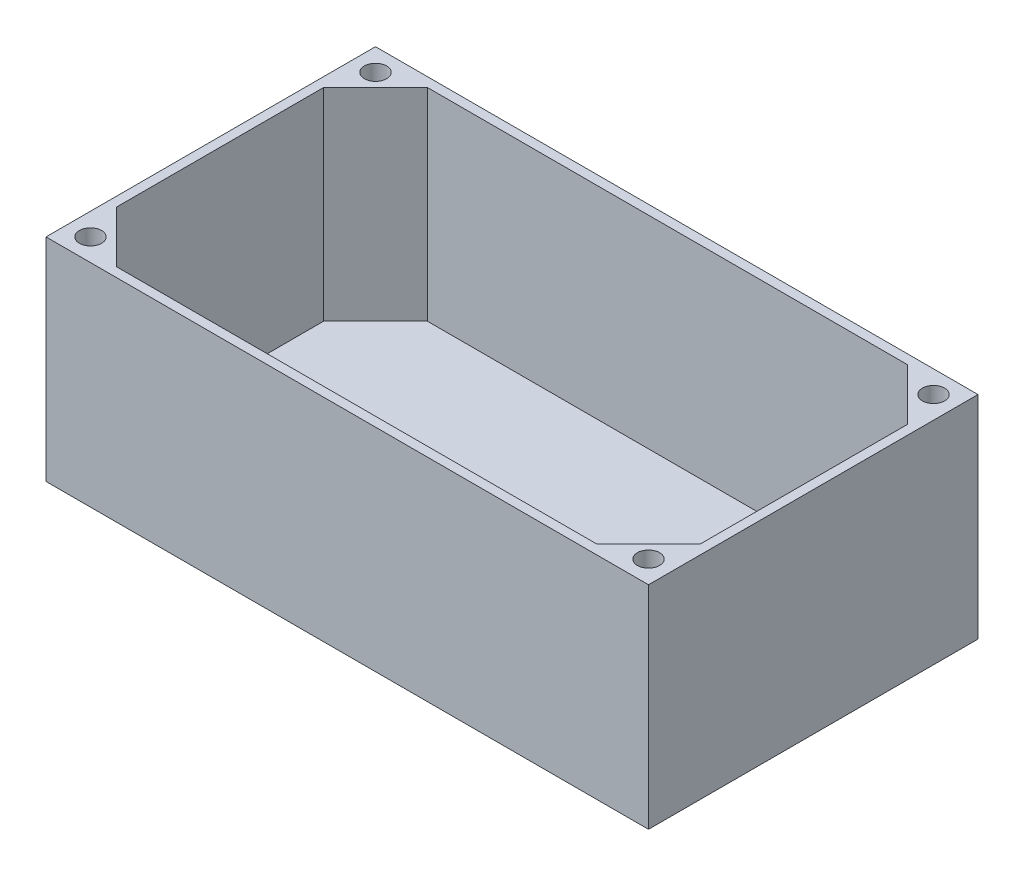
from build123d import *

# Parameters (mm, degrees)
SKETCH1_W           = 81.28
SKETCH1_H           = 44.45
BOSS_EXTRUDE1_DEPTH = 28.575
SHELL1_T            = -1.27
CHAMFER1_SIZE       = 6.985
SKETCH2_R           = 1.5
CUT_EXTRUDE1_DEPTH  = 97.947261565
SKETCH3_R           = 3.175
SKETCH3_R_2         = 4.445
SKETCH3_W           = 4
SKETCH3_H           = 12
SKETCH3_W_2         = 16.764
SKETCH3_H_2         = 12.192
CUT_EXTRUDE2_DEPTH  = 97.580556661
BOSS_EXTRUDE2_START = 8.89
SKETCH4_R           = 5.715
SKETCH4_R_2         = 4.445
SKETCH4_R_3         = 3.175
BOSS_EXTRUDE2_DEPTH = 8.89


with BuildPart() as part:
    # Sketch1 → Boss-Extrude1 (new body)
    with BuildSketch(Plane(origin=(0, 0, 0), x_dir=(1, 0, 0), z_dir=(0, 1, 0))):
        with Locations((40.64, 22.225)):
            Rectangle(SKETCH1_W, SKETCH1_H)
    extrude(amount=BOSS_EXTRUDE1_DEPTH)

    # Shell1
    shell1_openings = [part.faces().sort_by_distance(p)[0] for p in [
        (40.64, 28.575, -22.225),
    ]]
    offset(amount=SHELL1_T, openings=shell1_openings, kind=Kind.INTERSECTION)

    # Chamfer1
    chamfer1_edges = [part.edges().sort_by_distance(p)[0] for p in [
        (1.27, 14.9225, -43.18),
        (1.27, 14.9225, -1.27),
        (80.01, 14.9225, -1.27),
        (80.01, 14.9225, -43.18),
    ]]
    chamfer(chamfer1_edges, length=CHAMFER1_SIZE)

    # Sketch2 → Cut-Extrude1 (cut, through all)
    with BuildSketch(Plane(origin=(0, 28.575, 0), x_dir=(1, 0, 0), z_dir=(0, 1, 0))):
        with Locations(Location((3, 41.45, 0), (0, 0, 270))):
            Circle(SKETCH2_R)
        with Locations(Location((3, 3, 0), (0, 0, 270))):
            Circle(SKETCH2_R)
        with Locations(Location((78.28, 3, 0), (0, 0, 270))):
            Circle(SKETCH2_R)
        with Locations(Location((78.28, 41.45, 0), (0, 0, 270))):
            Circle(SKETCH2_R)
    extrude(amount=-CUT_EXTRUDE1_DEPTH, mode=Mode.SUBTRACT)

    # Sketch3 → Cut-Extrude2 (cut, through all)
    with BuildSketch(Plane(origin=(0, 1.27, 0), x_dir=(1, 0, 0), z_dir=(0, 1, 0))):
        with Locations(Location((67.31, 31.75, 0), (0, 0, 270))):
            Circle(SKETCH3_R)
        with Locations(Location((67.31, 18.415, 0), (0, 0, 270))):
            Circle(SKETCH3_R_2)
        with Locations((7.62, 22.225)):
            Rectangle(SKETCH3_W, SKETCH3_H)
        with Locations((40.64, 22.225)):
            Rectangle(SKETCH3_W_2, SKETCH3_H_2)
    extrude(amount=-CUT_EXTRUDE2_DEPTH, mode=Mode.SUBTRACT)

    # Sketch4 → Boss-Extrude2 (add)
    # profile 1 of 2: a face of its own
    with BuildSketch(Plane(origin=(0, 1.27, 0), x_dir=(1, 0, 0), z_dir=(0, 1, 0)).offset(BOSS_EXTRUDE2_START)):
        with Locations(Location((67.31, 18.415, 0), (0, 0, 90))):
            Circle(SKETCH4_R)
        with Locations(Location((67.31, 18.415, 0), (0, 0, 270))):
            Circle(SKETCH4_R_2, mode=Mode.SUBTRACT)
    # profile 2 of 2: a face of its own
    with BuildSketch(Plane(origin=(0, 1.27, 0), x_dir=(1, 0, 0), z_dir=(0, 1, 0)).offset(BOSS_EXTRUDE2_START)):
        with Locations(Location((67.31, 31.75, 0), (0, 0, 90))):
            Circle(SKETCH4_R_2)
        with Locations(Location((67.31, 31.75, 0), (0, 0, 270))):
            Circle(SKETCH4_R_3, mode=Mode.SUBTRACT)
    extrude(amount=-BOSS_EXTRUDE2_DEPTH)


solid = part.part
